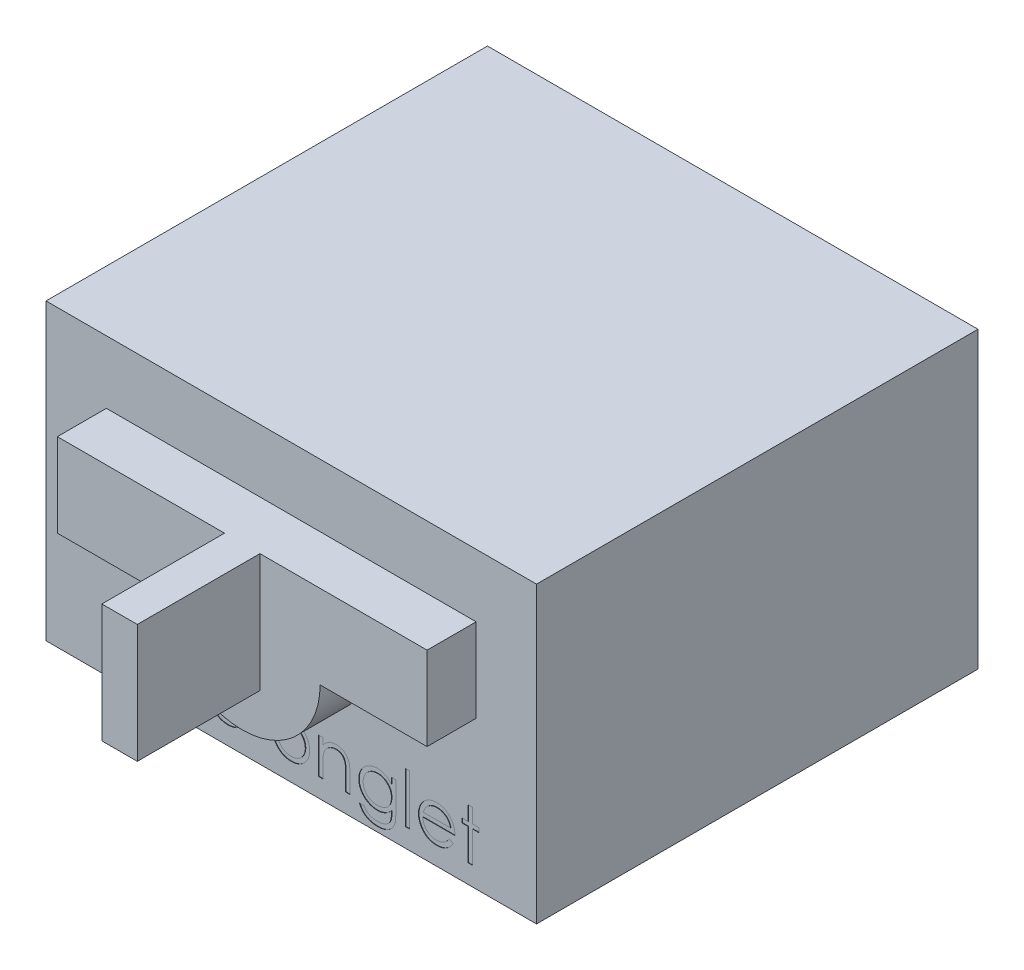
from build123d import *

# Parameters (mm, degrees)
ESQUISSE1_W             = 1000
ESQUISSE1_H             = 600
BOSS_EXTRU_1_DEPTH      = 900
BOSS_EXTRU_2_DEPTH      = 100
ESQUISSE3_W             = 72.275532634
ESQUISSE3_H             = 241.788641103
BOSS_EXTRU_3_DEPTH      = 250
ESQUISSE4_W             = 8.974358975
ESQUISSE4_H             = 73.076923077
ESQUISSE4_H_2           = 102.564102564
ENL_V_MAT_EXTRU_1_DEPTH = 1


with BuildPart() as part:
    # Esquisse1 → Boss.-Extru.1 (new body)
    with BuildSketch(Plane.XY):
        with Locations((500, 300)):
            Rectangle(ESQUISSE1_W, ESQUISSE1_H)
    extrude(amount=BOSS_EXTRU_1_DEPTH)

    # Esquisse2 → Boss.-Extru.2 (add)
    with BuildSketch(Plane.XY.offset(900)):
        with BuildLine():
            Line((123.134722697, 471.915742675), (123.134722697, 301.548761414))
            Line((123.134722697, 301.548761414), (341.132582134, 301.548761414))
            ThreePointArc((341.132582134, 301.548761414), (500, 142.681343548), (658.867417866, 301.548761414))
            Line((658.867417866, 301.548761414), (876.865277303, 301.548761414))
            Line((876.865277303, 301.548761414), (876.865277303, 471.915742675))
            Line((876.865277303, 471.915742675), (123.134722697, 471.915742675))
        make_face()
    extrude(amount=BOSS_EXTRU_2_DEPTH)

    # Esquisse3 → Boss.-Extru.3 (add)
    with BuildSketch(Plane.XY.offset(1000)):
        with Locations((500, 351.021422124)):
            Rectangle(ESQUISSE3_W, ESQUISSE3_H)
    extrude(amount=BOSS_EXTRU_3_DEPTH)

    # Esquisse4 → Enlèv. mat.-Extru.1 (cut)
    # profile 1 of 11: a face of its own
    with BuildSketch(Plane.XY.offset(900)):
        with BuildLine():
            Line((140.153931788, 57.550186491), (148.607457429, 62.618295465))
            add(Edge.make_bspline(
                [(148.607457429, 62.618295465), (149.393692779, 61.302170181), (150.900089368, 58.780524926), (153.412985344, 55.373152342), (156.016782806, 52.477090721), (158.730763764, 50.109187648), (161.538362282, 48.244933741), (164.457906675, 46.924869978), (167.479558409, 46.101556396), (169.535953309, 46.001553923), (170.562585634, 45.951628798)],
                knots=[0, 0, 0, 0, 1.272034388, 2.437168799, 3.508375237, 4.49857839, 5.41946034, 6.295179144, 7.148887113, 8, 8, 8, 8], degree=3))
            add(Edge.make_bspline(
                [(170.562585634, 45.951628798), (171.439353077, 45.976048013), (173.177546593, 46.024459163), (175.73646782, 46.489624936), (178.221662171, 47.204257191), (180.581908963, 48.227712377), (182.784640807, 49.465954826), (184.716260673, 50.961559898), (186.386149621, 52.636022918), (187.752124323, 54.504098765), (188.800125332, 56.513160154), (189.605613, 58.575330192), (190.052615105, 60.723003571), (190.119950918, 62.169016796), (190.153931788, 62.898744183)],
                knots=[0, 0, 0, 0, 1.095163259, 2.171163733, 3.241058638, 4.321873601, 5.38011039, 6.391990106, 7.366004449, 8.327778327, 9.272591725, 10.192022065, 11.087607919, 12, 12, 12, 12], degree=3))
            add(Edge.make_bspline(
                [(190.153931788, 62.898744183), (190.111808625, 63.731339889), (190.02617839, 65.423885293), (189.302421817, 67.921018235), (188.163871907, 70.392234521), (187.113510658, 71.920842109), (186.568194608, 72.714449311)],
                knots=[0, 0, 0, 0, 0.938893495, 1.908633276, 2.914225137, 4, 4, 4, 4], degree=3))
            add(Edge.make_bspline(
                [(186.568194608, 72.714449311), (186.120462774, 73.2872157), (185.180505795, 74.489667087), (183.564576864, 76.279530958), (181.668402169, 78.1257715), (179.556872029, 80.098887412), (177.15306949, 82.107110175), (174.532283365, 84.24620383), (171.62760168, 86.434820317), (169.590473205, 87.902607904), (168.539348454, 88.659962132)],
                knots=[0, 0, 0, 0, 0.722233717, 1.516239348, 2.393582979, 3.351407094, 4.387010283, 5.505090956, 6.712668013, 8, 8, 8, 8], degree=3))
            add(Edge.make_bspline(
                [(168.539348454, 88.659962132), (167.487234278, 89.409350349), (165.47567209, 90.842123556), (162.662569737, 92.968531671), (160.147013651, 94.912642229), (157.940184608, 96.692756861), (156.043053269, 98.309116996), (154.440670097, 99.746200971), (153.17385418, 101.042874139), (152.469409019, 101.884055332), (152.153130506, 102.261724952)],
                knots=[0, 0, 0, 0, 1.452282411, 2.77665338, 3.964542531, 5.026858415, 5.96415736, 6.766646006, 7.446254459, 8, 8, 8, 8], degree=3))
            add(Edge.make_bspline(
                [(152.153130506, 102.261724952), (151.711057785, 102.850326005), (150.84166245, 104.00788897), (149.694062294, 105.81717062), (148.718657642, 107.669263918), (147.954019581, 109.569145763), (147.310127615, 111.490143731), (146.87704388, 113.457322179), (146.605861111, 115.461854135), (146.578090067, 116.810811296), (146.564188198, 117.486083926)],
                knots=[0, 0, 0, 0, 1.068054152, 2.10047183, 3.106115577, 4.101338837, 5.06977816, 6.043150881, 7.020423561, 8, 8, 8, 8], degree=3))
            add(Edge.make_bspline(
                [(146.564188198, 117.486083926), (146.601479883, 118.544077485), (146.675266171, 120.637450735), (147.29928095, 123.695474462), (148.284220769, 126.615086382), (149.664074708, 129.367381632), (151.44285622, 131.880695371), (153.50131263, 134.183937857), (155.95306938, 136.120183063), (158.64314433, 137.81195616), (161.587612104, 139.136125451), (164.673066487, 140.135010599), (167.904411402, 140.70098939), (170.093072391, 140.782211245), (171.203611275, 140.82342367)],
                knots=[0, 0, 0, 0, 1.005424448, 1.989358655, 2.955360095, 3.929531133, 4.905563448, 5.876582895, 6.856512386, 7.866279853, 8.892233794, 9.918561126, 10.94386622, 12, 12, 12, 12], degree=3))
            add(Edge.make_bspline(
                [(171.203611275, 140.82342367), (172.382014141, 140.782779339), (174.725481333, 140.701950736), (178.172601778, 139.999164127), (181.49147939, 138.83628779), (184.161286956, 137.516611848), (186.250794426, 136.198571399), (187.844301074, 134.998004991), (189.459085383, 133.615859031), (191.108172663, 132.048452), (192.763620076, 130.281401969), (194.450004426, 128.326810857), (196.171269249, 126.196623546), (197.278579538, 124.675923525), (197.84623948, 123.896340337)],
                knots=[0, 0, 0, 0, 1.286793592, 2.559021753, 3.825965368, 5.121522368, 5.803751409, 6.523245864, 7.299691795, 8.125521123, 9.008227632, 9.944561021, 10.946284179, 12, 12, 12, 12], degree=3))
            Line((197.84623948, 123.896340337), (189.733258711, 117.746500593))
            add(Edge.make_bspline(
                [(189.733258711, 117.746500593), (189.243374926, 118.377606034), (188.299973295, 119.592967554), (186.867702242, 121.295005143), (185.517740873, 122.849761701), (184.18772945, 124.200193931), (182.947911409, 125.420254883), (181.744567344, 126.464819364), (180.595014452, 127.34412209), (179.145959862, 128.282509518), (177.325453624, 129.212695334), (175.04018116, 129.99981185), (172.652001874, 130.472813619), (171.025440974, 130.535353264), (170.202008711, 130.567013414)],
                knots=[0, 0, 0, 0, 1.181633172, 2.275549214, 3.290209073, 4.226197932, 5.078386478, 5.862611352, 6.581680152, 7.217281963, 8.414376989, 9.595101626, 10.782541182, 12, 12, 12, 12], degree=3))
            add(Edge.make_bspline(
                [(170.202008711, 130.567013414), (169.168965213, 130.532393415), (167.176838144, 130.465632009), (164.348545684, 129.736489572), (161.803004968, 128.58843642), (159.615788824, 126.979437046), (157.794732337, 125.07312297), (156.477433515, 122.879441396), (155.684571671, 120.457087036), (155.587820823, 118.767325426), (155.538547172, 117.906757003)],
                knots=[0, 0, 0, 0, 1.14458467, 2.207223713, 3.21896685, 4.227309161, 5.202851033, 6.127160689, 7.046193047, 8, 8, 8, 8], degree=3))
            add(Edge.make_bspline(
                [(155.538547172, 117.906757003), (155.549779362, 117.371000474), (155.572262108, 116.298611347), (155.885827756, 114.714285005), (156.288665726, 113.133961022), (156.927026633, 111.56474437), (157.808321023, 109.979191254), (158.965611763, 108.349998752), (160.423134964, 106.662807076), (161.539621031, 105.565453539), (162.129092044, 104.986083926)],
                knots=[0, 0, 0, 0, 0.858281714, 1.717966888, 2.583508476, 3.4729293, 4.427298488, 5.488583878, 6.674047936, 8, 8, 8, 8], degree=3))
            add(Edge.make_bspline(
                [(162.129092044, 104.986083926), (162.347988399, 104.790740332), (162.868036031, 104.326648665), (163.818776766, 103.566869218), (165.074285287, 102.629647153), (166.60177675, 101.470009539), (168.429415656, 100.124824907), (170.557402974, 98.611293131), (172.962018198, 96.880280017), (174.668358653, 95.670064571), (175.570598454, 95.030154439)],
                knots=[0, 0, 0, 0, 0.420754252, 0.999615792, 1.744751191, 2.668019286, 3.750313428, 4.999500688, 6.413464383, 8, 8, 8, 8], degree=3))
            add(Edge.make_bspline(
                [(175.570598454, 95.030154439), (176.655910263, 94.240401309), (178.75746616, 92.711153831), (181.747682729, 90.413562973), (184.458934388, 88.166483871), (186.900740205, 85.984266525), (189.097223303, 83.883463868), (191.024015322, 81.838801573), (192.700749046, 79.864928067), (194.505869574, 77.334283048), (196.350378703, 74.226252068), (197.934421772, 70.418302396), (198.9332317, 66.595550381), (199.063846426, 64.026212196), (199.128290762, 62.758519824)],
                knots=[0, 0, 0, 0, 1.163667725, 2.253281268, 3.268753668, 4.215851969, 5.092017293, 5.902905408, 6.650798638, 7.335211899, 8.59617414, 9.77448103, 10.901945474, 12, 12, 12, 12], degree=3))
            add(Edge.make_bspline(
                [(199.128290762, 62.758519824), (199.109515387, 61.861995107), (199.072329242, 60.086355577), (198.644874563, 57.479067666), (198.018598415, 54.946757104), (197.074677445, 52.52072532), (195.922587209, 50.156589243), (194.460694413, 47.916363517), (192.766189135, 45.750466414), (190.822367281, 43.716652376), (188.6953415, 41.849618205), (186.447235938, 40.188787877), (184.074370997, 38.803978637), (181.589619092, 37.673954578), (178.992409472, 36.790139792), (176.283615648, 36.149772103), (173.45877247, 35.756751791), (171.538758711, 35.715958606), (170.562585634, 35.695218542)],
                knots=[0, 0, 0, 0, 0.983748083, 1.948392443, 2.894712957, 3.844097841, 4.80183111, 5.778335162, 6.776009319, 7.81870978, 8.863265674, 9.881300176, 10.883814829, 11.87499822, 12.874611388, 13.892143829, 14.928324115, 16, 16, 16, 16], degree=3))
            add(Edge.make_bspline(
                [(170.562585634, 35.695218542), (169.80729012, 35.70982373), (168.306211261, 35.73885017), (166.085940351, 35.995458182), (163.910523516, 36.358518285), (161.807258316, 36.934920284), (159.749046554, 37.634262485), (157.744839854, 38.495357702), (155.793666886, 39.527277744), (153.88459309, 40.70713559), (152.022473816, 42.080214006), (150.224774732, 43.679456762), (148.432512289, 45.460756904), (146.69858668, 47.472487286), (144.987925414, 49.682146796), (143.33425657, 52.110409179), (141.703350351, 54.744047858), (140.68005127, 56.597336021), (140.153931788, 57.550186491)],
                knots=[0, 0, 0, 0, 0.915332311, 1.819136955, 2.706846663, 3.586547465, 4.459518054, 5.340707479, 6.227863349, 7.133153174, 8.059268498, 9.028702269, 10.047606654, 11.120612155, 12.245963614, 13.433783089, 14.680604001, 16, 16, 16, 16], degree=3))
        make_face()
    # profile 2 of 11: a face of its own
    with BuildSketch(Plane.XY.offset(900)):
        with BuildLine():
            Line((288.871880506, 95.490891619), (281.359861275, 90.82342367))
            add(Edge.make_bspline(
                [(281.359861275, 90.82342367), (280.536150835, 91.847092065), (278.914816686, 93.862009503), (276.099409933, 96.46229331), (273.099083812, 98.695637361), (269.862568163, 100.515744531), (266.394402448, 101.922071684), (262.70826384, 102.917220413), (258.804677986, 103.537341637), (256.128529442, 103.60782269), (254.757297172, 103.643936491)],
                knots=[0, 0, 0, 0, 1.026593902, 2.0206758, 2.988051866, 3.946915611, 4.916868779, 5.907761954, 6.927957743, 8, 8, 8, 8], degree=3))
            add(Edge.make_bspline(
                [(254.757297172, 103.643936491), (253.661326975, 103.613740999), (251.502843471, 103.554271799), (248.33409623, 103.182543417), (245.315743283, 102.507057466), (242.428865886, 101.617030132), (239.693996785, 100.424164705), (237.103970544, 98.972457387), (234.635813686, 97.285313378), (232.361049648, 95.330726367), (230.280220874, 93.205050148), (228.477394759, 90.926373138), (226.907768096, 88.562947675), (225.676169344, 86.05575504), (224.66830733, 83.462153518), (224.005258182, 80.733186213), (223.563409741, 77.903814568), (223.512857495, 75.974719147), (223.487265121, 74.998103157)],
                knots=[0, 0, 0, 0, 1.112346261, 2.190735716, 3.231507886, 4.247384806, 5.251966152, 6.253067467, 7.256802811, 8.280671706, 9.291813951, 10.270744147, 11.225547591, 12.165006084, 13.100104208, 14.043489273, 15.009504848, 16, 16, 16, 16], degree=3))
            add(Edge.make_bspline(
                [(223.487265121, 74.998103157), (223.538100898, 73.718982842), (223.639087485, 71.177977248), (224.430557763, 67.42717434), (225.726112257, 63.800783187), (227.499193705, 60.324550698), (229.741397545, 57.107574833), (232.374899354, 54.222333279), (235.401158875, 51.724732473), (238.793511183, 49.654088899), (242.472303853, 47.989478396), (246.397735417, 46.803554599), (250.537729144, 46.087772526), (253.372207632, 45.997602725), (254.817393326, 45.951628798)],
                knots=[0, 0, 0, 0, 0.966302908, 1.919585723, 2.883856336, 3.870342332, 4.860282998, 5.839159637, 6.814385684, 7.815993281, 8.834850808, 9.858348828, 10.908058873, 12, 12, 12, 12], degree=3))
            add(Edge.make_bspline(
                [(254.817393326, 45.951628798), (256.141827166, 45.98875729), (258.74469112, 46.061724628), (262.549470694, 46.676837866), (266.171753861, 47.683798826), (269.611411877, 49.088017399), (272.862159479, 50.903089282), (275.902993048, 53.141922733), (278.794419856, 55.740111314), (280.494333473, 57.749196208), (281.359861275, 58.772141619)],
                knots=[0, 0, 0, 0, 1.039848629, 2.043578496, 3.018386758, 3.987534228, 4.954977003, 5.934852016, 6.948509513, 8, 8, 8, 8], degree=3))
            Line((281.359861275, 58.772141619), (288.871880506, 53.844257003))
            add(Edge.make_bspline(
                [(288.871880506, 53.844257003), (288.426517585, 53.190236234), (287.53726996, 51.884365474), (286.050766375, 50.043104997), (284.447342612, 48.31962836), (282.73325413, 46.716245785), (280.930882421, 45.194588093), (278.978656432, 43.82740025), (276.939524676, 42.537833887), (274.789548741, 41.377466109), (272.550957369, 40.334428351), (270.226900523, 39.437537759), (267.827477303, 38.666963305), (265.349866555, 38.054467683), (262.789183746, 37.565586583), (260.152051334, 37.24119511), (257.439377574, 36.999044221), (255.605887536, 36.984590881), (254.677168967, 36.977269824)],
                knots=[0, 0, 0, 0, 0.954134338, 1.905101784, 2.851144739, 3.791306361, 4.734911809, 5.6936923, 6.663572882, 7.643865596, 8.638447847, 9.640600242, 10.646758161, 11.676244097, 12.717260333, 13.78922464, 14.880174919, 16, 16, 16, 16], degree=3))
            add(Edge.make_bspline(
                [(254.677168967, 36.977269824), (253.259715148, 37.002734961), (250.481495374, 37.052646815), (246.415138013, 37.601460397), (242.529033236, 38.428820863), (238.824508722, 39.616356117), (235.300987744, 41.145063982), (231.961755794, 43.012404399), (228.81786956, 45.23388411), (225.900418624, 47.769963235), (223.220948734, 50.519695834), (220.920200438, 53.486836346), (218.924621277, 56.562294856), (217.322120047, 59.8139956), (216.046493577, 63.19872053), (215.174926932, 66.743584529), (214.61122014, 70.419363216), (214.545980725, 72.926016989), (214.512906147, 74.196821106)],
                knots=[0, 0, 0, 0, 1.1129367, 2.181364009, 3.217532258, 4.231199276, 5.232079859, 6.230262199, 7.231623845, 8.250719726, 9.263571943, 10.242672461, 11.195837495, 12.138959767, 13.085126421, 14.0317438, 15.002148558, 16, 16, 16, 16], degree=3))
            add(Edge.make_bspline(
                [(214.512906147, 74.196821106), (214.525506608, 75.059062093), (214.550571004, 76.774201731), (214.838054654, 79.319775065), (215.209439595, 81.831447789), (215.838746369, 84.277382627), (216.565621559, 86.694676629), (217.493493896, 89.054193809), (218.581933751, 91.366898747), (219.817703674, 93.626833879), (221.208810677, 95.796820721), (222.748274484, 97.846925426), (224.378112662, 99.801775868), (226.174573005, 101.593883316), (228.061420258, 103.294917353), (230.092036707, 104.859435191), (232.254775325, 106.292034933), (234.51715597, 107.619206802), (236.877862009, 108.800904948), (239.322624018, 109.818997458), (241.836710568, 110.689071055), (244.424143259, 111.377897319), (247.067748206, 111.955537986), (249.788357862, 112.318905023), (252.575564212, 112.575655678), (254.462879147, 112.603964026), (255.418354865, 112.618295465)],
                knots=[0, 0, 0, 0, 0.990994727, 1.971252077, 2.943264845, 3.907940874, 4.872158414, 5.844625996, 6.82015047, 7.809835459, 8.804511986, 9.781214284, 10.756496977, 11.728388426, 12.696359165, 13.676225489, 14.672885716, 15.677705647, 16.690706858, 17.706033469, 18.721040654, 19.747369689, 20.783475414, 21.830280724, 22.901553713, 24, 24, 24, 24], degree=3))
            add(Edge.make_bspline(
                [(255.418354865, 112.618295465), (256.61492938, 112.59195572), (259.00209737, 112.539407889), (262.543260418, 112.097160683), (266.032265957, 111.430405928), (269.407897485, 110.442610792), (272.629226469, 109.246506343), (275.644525046, 107.903285932), (278.382813728, 106.34344012), (280.89503056, 104.637151137), (283.185873913, 102.712553831), (285.278859416, 100.546640762), (287.216906536, 98.150684217), (288.31566972, 96.384806181), (288.871880506, 95.490891619)],
                knots=[0, 0, 0, 0, 1.095225653, 2.184976855, 3.262915854, 4.344593502, 5.400796181, 6.407717688, 7.363229445, 8.282371371, 9.184954523, 10.097238608, 11.036792983, 12, 12, 12, 12], degree=3))
        make_face()
    # profile 3 of 11: a face of its own
    with BuildSketch(Plane.XY.offset(900)):
        with BuildLine():
            add(Edge.make_bspline(
                [(309.985662557, 142.105474952), (310.542557294, 142.079642026), (311.633064146, 142.029056197), (313.210014651, 141.595871137), (314.645929282, 140.86159441), (315.919578793, 139.87646067), (317.012489841, 138.717905143), (317.777652995, 137.367591763), (318.269435741, 135.908773512), (318.328823035, 134.891199535), (318.359059993, 134.373103157)],
                knots=[0, 0, 0, 0, 1.055194115, 2.066272739, 3.074728998, 4.095836921, 5.109056067, 6.073838105, 7.019297344, 8, 8, 8, 8], degree=3))
            add(Edge.make_bspline(
                [(318.359059993, 134.373103157), (318.328141141, 133.868455924), (318.267018229, 132.870828066), (317.77803285, 131.437300293), (317.005968912, 130.105749337), (315.920279609, 128.949443331), (314.64574358, 127.964854188), (313.210063984, 127.230433077), (311.633051169, 126.797286295), (310.542552907, 126.746695188), (309.985662557, 126.720859567)],
                knots=[0, 0, 0, 0, 0.96129708, 1.900370562, 2.859976407, 3.87933698, 4.906634145, 5.921202961, 6.938410037, 8, 8, 8, 8], degree=3))
            add(Edge.make_bspline(
                [(309.985662557, 126.720859567), (309.435140409, 126.745708717), (308.363620976, 126.794074339), (306.810282623, 127.238931989), (305.386611498, 127.965105506), (304.110477993, 128.942996508), (303.04675819, 130.112850715), (302.272520321, 131.436487682), (301.784664267, 132.871034957), (301.723389164, 133.868525423), (301.692393326, 134.373103157)],
                knots=[0, 0, 0, 0, 1.054934014, 2.053291228, 3.073705704, 4.106921865, 5.123545215, 6.088680038, 7.033164197, 8, 8, 8, 8], degree=3))
            add(Edge.make_bspline(
                [(301.692393326, 134.373103157), (301.722710087, 134.891127432), (301.782254117, 135.908559792), (302.272886007, 137.368417875), (303.040309086, 138.710746498), (304.111182329, 139.882903625), (305.386424051, 140.861344618), (306.810331056, 141.587372661), (308.363608181, 142.032268072), (309.435136067, 142.080628481), (309.985662557, 142.105474952)],
                knots=[0, 0, 0, 0, 0.98631895, 1.937192651, 2.907499808, 3.917963147, 4.944918757, 5.95915025, 6.951458133, 8, 8, 8, 8], degree=3))
        make_face()
    # profile 4 of 11: a face of its own
    with BuildSketch(Plane.XY.offset(900)):
        with Locations((310.02572666, 74.797782645)):
            Rectangle(ESQUISSE4_W, ESQUISSE4_H)
    # profile 5 of 11: a face of its own
    with BuildSketch(Plane.XY.offset(900)):
        with BuildLine():
            Line((396.28373948, 61.336244183), (404.25649589, 57.149545465))
            add(Edge.make_bspline(
                [(404.25649589, 57.149545465), (403.621164598, 56.022593143), (402.385061498, 53.829990205), (400.259325844, 50.817651334), (398.030980913, 48.107716596), (395.59943897, 45.772583617), (393.037448143, 43.73682976), (390.330800863, 41.955749054), (387.465406071, 40.438077044), (384.44112822, 39.159433391), (381.232569616, 38.176304988), (377.831954862, 37.481898676), (374.232769279, 37.052662428), (371.765735569, 37.002801263), (370.50248948, 36.977269824)],
                knots=[0, 0, 0, 0, 1.120438281, 2.179929193, 3.190490725, 4.156257408, 5.095198341, 6.022838206, 6.959905092, 7.901321166, 8.864066838, 9.862729781, 10.905609505, 12, 12, 12, 12], degree=3))
            add(Edge.make_bspline(
                [(370.50248948, 36.977269824), (369.098432979, 37.010046262), (366.359525503, 37.073983597), (362.372675586, 37.625196867), (358.618977917, 38.524407115), (355.098643536, 39.780565443), (351.820293462, 41.421346132), (348.777411896, 43.420188469), (345.953996871, 45.766824317), (343.439019466, 48.481579845), (341.174908531, 51.386778625), (339.17702796, 54.41408961), (337.506815645, 57.555896024), (336.148169639, 60.792196711), (335.050887783, 64.102593669), (334.286124818, 67.517207028), (333.845274876, 71.02679515), (333.777719289, 73.401004741), (333.743675377, 74.597462132)],
                knots=[0, 0, 0, 0, 1.145258523, 2.234067595, 3.276747158, 4.290159414, 5.277019952, 6.260822364, 7.254936242, 8.264827045, 9.274100331, 10.257902744, 11.220704747, 12.172965371, 13.118907548, 14.062713208, 15.023725156, 16, 16, 16, 16], degree=3))
            add(Edge.make_bspline(
                [(333.743675377, 74.597462132), (333.773936558, 75.720171572), (333.833910223, 77.94523342), (334.21193272, 81.238534693), (334.88188395, 84.439347622), (335.801207491, 87.55033185), (336.988385954, 90.566278535), (338.440735074, 93.48902321), (340.160517297, 96.315455777), (341.488307976, 98.098402455), (342.157136916, 98.996500593)],
                knots=[0, 0, 0, 0, 1.024358464, 2.0301432, 3.019427413, 4.004406732, 4.986367066, 5.972626655, 6.978780325, 8, 8, 8, 8], degree=3))
            add(Edge.make_bspline(
                [(342.157136916, 98.996500593), (343.063070709, 100.07846831), (344.846240613, 102.208129751), (347.86213648, 105.006367631), (351.127856375, 107.350475493), (354.602474264, 109.293536526), (358.326373523, 110.76992644), (362.249496124, 111.870143075), (366.416512873, 112.486657676), (369.265233469, 112.573738636), (370.722842044, 112.618295465)],
                knots=[0, 0, 0, 0, 1.030682036, 2.02871468, 2.997146059, 3.962720338, 4.930598197, 5.918074684, 6.934738563, 8, 8, 8, 8], degree=3))
            add(Edge.make_bspline(
                [(370.722842044, 112.618295465), (372.221345053, 112.579608354), (375.161066365, 112.50371306), (379.447698395, 111.800103534), (383.503718868, 110.684316261), (387.327504705, 109.108493675), (390.919443584, 107.075363624), (394.256187857, 104.557025296), (397.394802501, 101.630794233), (399.220761897, 99.38041682), (400.149925377, 98.235282644)],
                knots=[0, 0, 0, 0, 1.056321875, 2.072262726, 3.055038591, 4.01806755, 4.982017516, 5.957941055, 6.960871419, 8, 8, 8, 8], degree=3))
            add(Edge.make_bspline(
                [(400.149925377, 98.235282644), (400.782123615, 97.372323176), (402.042311989, 95.652148357), (403.620800562, 92.847258154), (404.991011847, 89.912669744), (406.086239304, 86.80094697), (406.973082196, 83.548958965), (407.614705588, 80.133457687), (407.990980405, 76.55546022), (408.064943186, 74.117558635), (408.102649736, 72.874705721)],
                knots=[0, 0, 0, 0, 0.94817472, 1.890038105, 2.849395472, 3.817997239, 4.812318967, 5.836947057, 6.897266129, 8, 8, 8, 8], degree=3))
            Line((408.102649736, 72.874705721), (342.718034352, 72.874705721))
            add(Edge.make_bspline(
                [(342.718034352, 72.874705721), (342.762023107, 71.911835314), (342.84852522, 70.018389493), (343.251815024, 67.24779569), (343.887494275, 64.608557343), (344.780896065, 62.120470429), (345.862805929, 59.751038215), (347.188112123, 57.517837158), (348.769242236, 55.431039157), (350.532833647, 53.471978083), (352.495893514, 51.727384907), (354.561114863, 50.165905586), (356.758073863, 48.857174251), (359.069447677, 47.794891686), (361.491498681, 46.963282656), (364.02498997, 46.395630636), (366.664936151, 46.015427583), (368.464528552, 45.973151434), (369.380694608, 45.951628798)],
                knots=[0, 0, 0, 0, 1.094153842, 2.151609401, 3.174256925, 4.172055639, 5.149267565, 6.128595816, 7.11444997, 8.118368179, 9.117203808, 10.09244225, 11.054858984, 12.015122123, 12.976791628, 13.957293641, 14.960065497, 16, 16, 16, 16], degree=3))
            add(Edge.make_bspline(
                [(369.380694608, 45.951628798), (370.276441683, 45.969001846), (372.053775709, 46.003473304), (374.700657347, 46.338670759), (377.304643845, 46.880678634), (379.854957652, 47.620392636), (382.299838964, 48.522588411), (384.563997537, 49.611241486), (386.646289412, 50.815519965), (388.592488458, 52.192939252), (390.480231125, 53.878887452), (392.352873594, 55.982765195), (394.360777976, 58.470980274), (395.617623483, 60.343713588), (396.28373948, 61.336244183)],
                knots=[0, 0, 0, 0, 0.99110716, 1.966546729, 2.947904876, 3.932708344, 4.903319531, 5.828989031, 6.710028674, 7.56322171, 8.463672341, 9.504779593, 10.677557249, 12, 12, 12, 12], degree=3))
        make_face()
        with BuildLine():
            add(Edge.make_bspline(
                [(399.128290762, 81.849064696), (398.799815775, 83.039432516), (398.167607161, 85.33050739), (396.846568177, 88.50310426), (395.358809871, 91.322758574), (393.598188975, 93.767890947), (391.603368243, 95.93941989), (389.299220167, 97.837093752), (386.715337496, 99.534735211), (383.865076333, 100.967663767), (380.846739617, 102.187374016), (377.686562704, 103.005234466), (374.462054479, 103.565507103), (372.281074869, 103.61768163), (371.183579224, 103.643936491)],
                knots=[0, 0, 0, 0, 1.154881502, 2.222775134, 3.210006277, 4.132804581, 5.035138423, 5.962687519, 6.919655026, 7.923214229, 8.944639381, 9.960483929, 10.97369054, 12, 12, 12, 12], degree=3))
            add(Edge.make_bspline(
                [(371.183579224, 103.643936491), (370.28788098, 103.626460161), (368.517273864, 103.591913131), (365.908671916, 103.26419515), (363.403537661, 102.722485296), (360.983386587, 101.980629393), (358.679933205, 100.991812179), (356.44579697, 99.832291419), (354.337785649, 98.416817596), (353.019462921, 97.337993172), (352.353451018, 96.792974952)],
                knots=[0, 0, 0, 0, 1.04873581, 2.073130211, 3.073294108, 4.04793562, 5.032784715, 6.005352987, 6.992311501, 8, 8, 8, 8], degree=3))
            add(Edge.make_bspline(
                [(352.353451018, 96.792974952), (351.876500105, 96.361708791), (350.911267699, 95.48893119), (349.621538513, 93.985239574), (348.386667865, 92.363766369), (347.262849215, 90.562477095), (346.23206103, 88.601883409), (345.267490254, 86.498522403), (344.399307052, 84.236432967), (343.910846765, 82.66007756), (343.659540762, 81.849064696)],
                knots=[0, 0, 0, 0, 0.879870761, 1.780643979, 2.707998968, 3.669668524, 4.684282772, 5.740141944, 6.837334558, 8, 8, 8, 8], degree=3))
            Line((343.659540762, 81.849064696), (399.128290762, 81.849064696))
        make_face(mode=Mode.SUBTRACT)
    # profile 6 of 11: a face of its own
    with BuildSketch(Plane.XY.offset(900)):
        with BuildLine():
            add(Edge.make_bspline(
                [(499.809380506, 112.618295465), (501.18055973, 112.589098575), (503.869107089, 112.53185061), (507.806475257, 111.919994448), (511.564907712, 110.984355466), (515.158798917, 109.690882264), (518.542121644, 107.957112248), (521.76415719, 105.888275359), (524.81607173, 103.437344114), (526.645301137, 101.541399304), (527.573803583, 100.579032644)],
                knots=[0, 0, 0, 0, 1.054011418, 2.066658804, 3.057071809, 4.030435133, 4.997543892, 5.974964718, 6.972108034, 8, 8, 8, 8], degree=3))
            add(Edge.make_bspline(
                [(527.573803583, 100.579032644), (528.373287984, 99.65863305), (529.956784563, 97.83564613), (531.987233671, 94.879771474), (533.736421104, 91.818625743), (535.138219989, 88.611559266), (536.24350638, 85.286568662), (537.028240559, 81.832225486), (537.495010129, 78.256158424), (537.557952041, 75.827477336), (537.589829224, 74.597462132)],
                knots=[0, 0, 0, 0, 1.025258237, 2.030674902, 3.01204498, 3.988269485, 4.97094183, 5.956517959, 6.965070386, 8, 8, 8, 8], degree=3))
            add(Edge.make_bspline(
                [(537.589829224, 74.597462132), (537.561791014, 73.360317626), (537.506386206, 70.915662389), (536.98228288, 67.31510908), (536.167108998, 63.823828432), (535.00048505, 60.456437182), (533.504539071, 57.202642113), (531.679090856, 54.076654991), (529.511330366, 51.072308326), (527.054073316, 48.215112947), (524.338305426, 45.581792525), (521.392129759, 43.286699109), (518.273443081, 41.320369841), (514.940775844, 39.736472252), (511.424561935, 38.487623672), (507.717217132, 37.610480345), (503.824500837, 37.080146523), (501.166580227, 37.01204443), (499.809380506, 36.977269824)],
                knots=[0, 0, 0, 0, 0.998656419, 1.973391657, 2.932242238, 3.890759089, 4.846373663, 5.82037756, 6.809684879, 7.83454468, 8.860553229, 9.859544525, 10.845671541, 11.83227036, 12.833544569, 13.85385346, 14.904124723, 16, 16, 16, 16], degree=3))
            add(Edge.make_bspline(
                [(499.809380506, 36.977269824), (498.445531377, 37.012161144), (495.774363956, 37.080497558), (491.86790733, 37.608419922), (488.153918217, 38.487219424), (484.633101117, 39.740576359), (481.286105489, 41.320420466), (478.149348434, 43.280754454), (475.200779419, 45.582473175), (472.484437007, 48.21492852), (470.027333998, 51.072355843), (467.859533759, 54.076642657), (466.034095869, 57.202645327), (464.538147187, 60.456436325), (463.371523961, 63.823828662), (462.556349884, 67.315109018), (462.032246611, 70.915662405), (461.976841795, 73.360317632), (461.948803583, 74.597462132)],
                knots=[0, 0, 0, 0, 1.099876186, 2.154163076, 3.173186993, 4.173200201, 5.163417411, 6.152872554, 7.150605724, 8.17532212, 9.198891216, 10.186952605, 11.159729845, 12.11414092, 13.071450619, 14.029093627, 15.002601286, 16, 16, 16, 16], degree=3))
            add(Edge.make_bspline(
                [(461.948803583, 74.597462132), (461.980898164, 75.820792014), (462.04443992, 78.24277494), (462.510740179, 81.81211953), (463.292413221, 85.260616361), (464.399024549, 88.572772817), (465.813744288, 91.765785276), (467.538352515, 94.834494732), (469.589513445, 97.777003317), (471.16671206, 99.597634175), (471.964829224, 100.518936491)],
                knots=[0, 0, 0, 0, 1.031353054, 2.041901799, 3.029428768, 4.008703097, 4.981709435, 5.96992636, 6.972712378, 8, 8, 8, 8], degree=3))
            add(Edge.make_bspline(
                [(471.964829224, 100.518936491), (472.891931824, 101.489649041), (474.71524222, 103.398726075), (477.782348727, 105.842512478), (480.996457901, 107.954400302), (484.417170076, 109.653720744), (488.008108875, 110.991964107), (491.785801519, 111.922407396), (495.736530532, 112.52964611), (498.438233992, 112.58845119), (499.809380506, 112.618295465)],
                knots=[0, 0, 0, 0, 1.027980169, 2.021703884, 2.998553061, 3.971491411, 4.943284454, 5.930300938, 6.949603206, 8, 8, 8, 8], degree=3))
        make_face()
        with BuildLine():
            add(Edge.make_bspline(
                [(499.769316403, 103.643936491), (498.799670365, 103.616376728), (496.885409546, 103.561968655), (494.067707126, 103.148142806), (491.355131299, 102.492499833), (488.742535753, 101.560955368), (486.238730827, 100.358129685), (483.841319329, 98.880747965), (481.543249618, 97.14837778), (479.389476379, 95.16373002), (477.412838888, 92.995758747), (475.6848967, 90.685805636), (474.215607947, 88.2713386), (472.991603405, 85.749846853), (472.07996946, 83.095777884), (471.417883103, 80.33918842), (471.004447661, 77.474462235), (470.95055113, 75.527004569), (470.923162557, 74.537365978)],
                knots=[0, 0, 0, 0, 1.021534396, 2.016698045, 2.994645724, 3.958388632, 4.93408049, 5.916473867, 6.921342795, 7.962252576, 8.998418191, 10.008913653, 10.997312074, 11.973003931, 12.956656626, 13.948281152, 14.957379055, 16, 16, 16, 16], degree=3))
            add(Edge.make_bspline(
                [(470.923162557, 74.537365978), (470.969071804, 73.25873663), (471.060193074, 70.720896473), (471.801199829, 66.983435826), (473.040807826, 63.395382908), (474.714730103, 59.977771878), (476.812050637, 56.815706792), (479.283109685, 53.996521524), (482.101386838, 51.562641197), (485.233286843, 49.543188467), (488.614838784, 47.938624019), (492.193590815, 46.801510427), (495.926182074, 46.062319215), (498.477060107, 45.988848519), (499.769316403, 45.951628798)],
                knots=[0, 0, 0, 0, 1.016792936, 2.018143844, 3.017858371, 4.030088057, 5.03801393, 6.028138512, 7.003788237, 7.991172063, 8.984598303, 9.972568034, 10.972917682, 12, 12, 12, 12], degree=3))
            add(Edge.make_bspline(
                [(499.769316403, 45.951628798), (501.061498373, 45.989065377), (503.612229686, 46.062964144), (507.339634739, 46.797787565), (510.908605363, 47.943606442), (514.286645007, 49.541383868), (517.417119391, 51.570310004), (520.255665714, 53.98277792), (522.705626032, 56.823173673), (524.800871887, 59.981960211), (526.502207393, 63.390084556), (527.736013158, 66.984098051), (528.478801326, 70.72072782), (528.569682147, 73.258680127), (528.615470249, 74.537365978)],
                knots=[0, 0, 0, 0, 1.02726834, 2.027799167, 3.010890988, 4.004497153, 4.992059811, 5.971914811, 6.958719428, 7.966827853, 8.981595046, 9.981490638, 10.983022906, 12, 12, 12, 12], degree=3))
            add(Edge.make_bspline(
                [(528.615470249, 74.537365978), (528.588091106, 75.527010484), (528.534213131, 77.474479788), (528.12064272, 80.33912132), (527.459055872, 83.09602408), (526.545581094, 85.74893846), (525.326894984, 88.277867155), (523.829272324, 90.678716499), (522.108385884, 93.003760672), (520.107896716, 95.156721838), (517.956371633, 97.149151454), (515.657370542, 98.881419723), (513.263514012, 100.351636737), (510.766983078, 101.57124361), (508.154052574, 102.484024762), (505.445277455, 103.15192852), (502.639597171, 103.560219852), (500.732195938, 103.615852465), (499.769316403, 103.643936491)],
                knots=[0, 0, 0, 0, 1.042956736, 2.052379634, 3.044323526, 4.02829302, 5.004299113, 5.996692471, 7.007513377, 8.048758398, 9.090003419, 10.095195979, 11.07790575, 12.047570684, 13.018257071, 13.989683339, 14.985167495, 16, 16, 16, 16], degree=3))
        make_face(mode=Mode.SUBTRACT)
    # profile 7 of 11: a face of its own
    with BuildSketch(Plane.XY.offset(900)):
        with BuildLine():
            Line((555.538547172, 111.336244183), (564.512906147, 111.336244183))
            Line((564.512906147, 111.336244183), (564.512906147, 98.155154439))
            add(Edge.make_bspline(
                [(564.512906147, 98.155154439), (565.471124293, 99.350660806), (567.330580037, 101.67058262), (570.427275274, 104.719741893), (573.69995814, 107.232462609), (577.128586811, 109.23542815), (580.717815671, 110.745331754), (584.445766242, 111.835786928), (588.334757844, 112.489639172), (590.979456041, 112.575074324), (592.317393326, 112.618295465)],
                knots=[0, 0, 0, 0, 1.12780773, 2.188550248, 3.19190651, 4.159438251, 5.104880172, 6.052711206, 7.014878035, 8, 8, 8, 8], degree=3))
            add(Edge.make_bspline(
                [(592.317393326, 112.618295465), (593.669697158, 112.568432738), (596.316481951, 112.470839354), (600.170140848, 111.698933894), (603.769380668, 110.380498033), (607.101367976, 108.574438879), (610.105002643, 106.328539638), (612.742855543, 103.712031588), (614.924662611, 100.70242921), (616.387444411, 97.910339032), (617.351034345, 95.433516338), (617.957672559, 93.312180621), (618.472843458, 90.948804873), (618.91946483, 88.350530901), (619.221668026, 85.499154036), (619.460019213, 82.406362835), (619.63083905, 79.073159106), (619.637616392, 76.767826894), (619.641111275, 75.579032644)],
                knots=[0, 0, 0, 0, 1.235846778, 2.418850247, 3.575807741, 4.728682307, 5.871620074, 6.994088408, 8.11269785, 9.256955736, 9.865816715, 10.540099792, 11.271859618, 12.076849838, 12.949306005, 13.892391288, 14.913166135, 16, 16, 16, 16], degree=3))
            Line((619.641111275, 75.579032644), (619.641111275, 38.259321106))
            Line((619.641111275, 38.259321106), (610.6667523, 38.259321106))
            Line((610.6667523, 38.259321106), (610.6667523, 72.634321106))
            add(Edge.make_bspline(
                [(610.6667523, 72.634321106), (610.661232071, 73.629248104), (610.650672813, 75.532374126), (610.617368622, 78.25720336), (610.537088433, 80.728248457), (610.424279492, 82.939601812), (610.259164334, 84.889139999), (610.087089153, 86.58083362), (609.876661245, 88.012534833), (609.689149441, 88.874394329), (609.605053583, 89.26092367)],
                knots=[0, 0, 0, 0, 1.430800155, 2.736877192, 3.918605307, 4.986035426, 5.920637409, 6.731861385, 7.431261377, 8, 8, 8, 8], degree=3))
            add(Edge.make_bspline(
                [(609.605053583, 89.26092367), (609.301466968, 90.395528954), (608.717156663, 92.579293086), (607.273328574, 95.541417447), (605.450066266, 98.061365671), (603.224413427, 100.123557717), (600.617868408, 101.728438766), (597.637664329, 102.841980329), (594.31256031, 103.538445164), (591.973863662, 103.607791793), (590.754893326, 103.643936491)],
                knots=[0, 0, 0, 0, 1.084156227, 2.086665306, 3.027808233, 3.945421172, 4.874247719, 5.839848303, 6.874090471, 8, 8, 8, 8], degree=3))
            add(Edge.make_bspline(
                [(590.754893326, 103.643936491), (590.032959509, 103.630336357), (588.604271137, 103.603422045), (586.485700511, 103.333384959), (584.430724135, 102.891714799), (582.418718164, 102.295468013), (580.489924057, 101.476546035), (578.58237288, 100.547135457), (576.767893905, 99.388615115), (575.007796844, 98.097454502), (573.370288054, 96.666620011), (571.846621243, 95.156776864), (570.488392093, 93.54890247), (569.257858513, 91.868903969), (568.195622417, 90.093708597), (567.268391329, 88.240442698), (566.481657192, 86.306667017), (566.090723122, 84.964522411), (565.895117685, 84.292974952)],
                knots=[0, 0, 0, 0, 1.023777757, 2.026029729, 3.023749952, 4.003683103, 4.997618607, 5.993177895, 7.010360494, 8.046726602, 9.087585522, 10.09234134, 11.086953743, 12.070360549, 13.043493632, 14.017870808, 15.008233677, 16, 16, 16, 16], degree=3))
            add(Edge.make_bspline(
                [(565.895117685, 84.292974952), (565.782556297, 83.799969151), (565.537516044, 82.72672131), (565.272853762, 80.965452185), (565.032637322, 78.928024328), (564.831581362, 76.616815269), (564.708569463, 74.023733123), (564.574443841, 71.159852043), (564.525613524, 68.013752376), (564.517260552, 65.823418298), (564.512906147, 64.681596747)],
                knots=[0, 0, 0, 0, 0.615963638, 1.340920617, 2.168419149, 3.115676021, 4.16674242, 5.331190069, 6.6087489, 8, 8, 8, 8], degree=3))
            Line((564.512906147, 64.681596747), (564.512906147, 38.259321106))
            Line((564.512906147, 38.259321106), (555.538547172, 38.259321106))
            Line((555.538547172, 38.259321106), (555.538547172, 111.336244183))
        make_face()
    # profile 8 of 11: a face of its own
    with BuildSketch(Plane.XY.offset(900)):
        with BuildLine():
            Line((704.25649589, 111.336244183), (713.230854865, 111.336244183))
            Line((713.230854865, 111.336244183), (713.230854865, 53.343455721))
            add(Edge.make_bspline(
                [(713.230854865, 53.343455721), (713.222939363, 52.108095875), (713.207660537, 49.723553798), (713.097632787, 46.275602952), (712.865613438, 43.090857651), (712.602508256, 40.15479312), (712.224030647, 37.481018547), (711.761848726, 35.061555556), (711.240829322, 32.894082346), (710.783108823, 31.559086888), (710.566592044, 30.927590337)],
                knots=[0, 0, 0, 0, 1.307562039, 2.523909702, 3.650326591, 4.686913197, 5.643429486, 6.506965704, 7.293745905, 8, 8, 8, 8], degree=3))
            add(Edge.make_bspline(
                [(710.566592044, 30.927590337), (710.246899509, 30.106735434), (709.617073039, 28.489568662), (708.437483512, 26.197159496), (707.116514837, 24.038691215), (705.607750533, 22.026192606), (703.918013275, 20.169766539), (702.087113499, 18.429080845), (700.079393744, 16.840961777), (697.896001967, 15.432810421), (695.58726959, 14.164608874), (693.154523816, 13.066135525), (690.61148272, 12.109368565), (687.934257246, 11.392717258), (685.164821975, 10.771725242), (682.270609659, 10.367591362), (679.26852975, 10.092532559), (677.227233176, 10.067097331), (676.191592044, 10.054192901)],
                knots=[0, 0, 0, 0, 0.981931301, 1.934503488, 2.87077864, 3.801706999, 4.735015492, 5.667491629, 6.616593066, 7.585388521, 8.561939025, 9.551802639, 10.560317337, 11.588439944, 12.640189604, 13.723962949, 14.845264515, 16, 16, 16, 16], degree=3))
            add(Edge.make_bspline(
                [(676.191592044, 10.054192901), (674.680599627, 10.078663924), (671.729225477, 10.126462407), (667.426225686, 10.683345695), (663.339519403, 11.470613497), (659.523106354, 12.662197144), (656.001103587, 14.12039685), (652.797564286, 15.794538363), (649.941246928, 17.714232901), (647.366284842, 19.899964355), (645.04223941, 22.498926688), (642.85574541, 25.561750806), (640.751147072, 29.135090496), (639.517757418, 31.757739445), (638.871880506, 33.131115978)],
                knots=[0, 0, 0, 0, 1.157897085, 2.2616841, 3.32207898, 4.345638746, 5.321241055, 6.241986252, 7.112515963, 7.955008012, 8.825025602, 9.77857164, 10.836726669, 12, 12, 12, 12], degree=3))
            Line((638.871880506, 33.131115978), (647.84623948, 33.131115978))
            add(Edge.make_bspline(
                [(647.84623948, 33.131115978), (648.568016889, 31.985233813), (649.979002843, 29.745175284), (652.617530871, 26.8447994), (655.509140195, 24.366131838), (658.751416857, 22.36868115), (662.357851583, 20.86268711), (666.330614045, 19.789107212), (670.702031809, 19.146356731), (673.745409357, 19.068891184), (675.330213839, 19.028551875)],
                knots=[0, 0, 0, 0, 0.997731894, 1.950442991, 2.880492273, 3.800895997, 4.748200782, 5.754801363, 6.83083817, 8, 8, 8, 8], degree=3))
            add(Edge.make_bspline(
                [(675.330213839, 19.028551875), (676.894982135, 19.069413269), (679.911698782, 19.148189947), (684.249732183, 19.789394066), (688.209587556, 20.862920745), (691.768450431, 22.366017495), (694.884329533, 24.207457682), (697.570386426, 26.264602665), (699.745948602, 28.584059894), (701.209176221, 30.720682925), (702.118736724, 32.624229488), (702.697943489, 34.262875087), (703.16862833, 36.115814449), (703.562337974, 38.176835483), (703.887221213, 40.448882828), (704.093017852, 42.937151496), (704.241755325, 45.63598642), (704.251468749, 47.50721894), (704.25649589, 48.47566726)],
                knots=[0, 0, 0, 0, 1.570740765, 3.028230971, 4.391408896, 5.680370741, 6.894727393, 8.017376726, 9.065722033, 10.075533815, 10.603371122, 11.180248986, 11.817768598, 12.521299649, 13.286540596, 14.121245857, 15.027658897, 16, 16, 16, 16], degree=3))
            Line((704.25649589, 48.47566726), (704.25649589, 52.261724952))
            add(Edge.make_bspline(
                [(704.25649589, 52.261724952), (703.345606822, 51.177673462), (701.539850944, 49.028638615), (698.421355883, 46.212591852), (695.015158293, 43.787273844), (691.327057082, 41.79817), (687.44739302, 40.207272154), (683.418186437, 39.094616129), (679.275556288, 38.375761846), (676.468352008, 38.298409954), (675.049765121, 38.259321106)],
                knots=[0, 0, 0, 0, 1.012485704, 2.007162095, 2.997754123, 3.998611389, 4.999708251, 5.992315798, 6.98544096, 8, 8, 8, 8], degree=3))
            add(Edge.make_bspline(
                [(675.049765121, 38.259321106), (674.214443138, 38.274036148), (672.55368435, 38.303292095), (670.086405858, 38.559257164), (667.655536191, 38.930649801), (665.266744659, 39.475833772), (662.916584286, 40.175597387), (660.608938797, 41.050361351), (658.325123752, 42.03936473), (656.106652384, 43.204301972), (653.975620078, 44.500367882), (651.948100502, 45.904336188), (650.034713671, 47.408858709), (648.253671116, 49.028771275), (646.607309074, 50.761729354), (645.073484273, 52.58925944), (643.677560071, 54.536880622), (642.390891807, 56.569079408), (641.274961796, 58.699391517), (640.295408315, 60.881622815), (639.443711028, 63.111107229), (638.76469955, 65.395309019), (638.246096314, 67.732788129), (637.860089829, 70.11971524), (637.641148924, 72.563440601), (637.607008237, 74.209764864), (637.589829224, 75.03816726)],
                knots=[0, 0, 0, 0, 1.028754217, 2.045334182, 3.052854819, 4.056607503, 5.061168794, 6.071104265, 7.095078842, 8.125279047, 9.155117945, 10.165957491, 11.161587969, 12.151493252, 13.128948131, 14.104219989, 15.088194871, 16.07871515, 17.064853787, 18.047899887, 19.02414258, 20.002704429, 20.980574569, 21.971845993, 22.979467364, 24, 24, 24, 24], degree=3))
            add(Edge.make_bspline(
                [(637.589829224, 75.03816726), (637.604662546, 75.866827145), (637.634271738, 77.520937397), (637.890014006, 79.974634122), (638.254819418, 82.395475129), (638.832184246, 84.758507749), (639.527113461, 87.090643514), (640.387786962, 89.374656554), (641.422608658, 91.611242528), (642.594315791, 93.802057713), (643.911004153, 95.917703854), (645.354789319, 97.927036594), (646.927414298, 99.815270077), (648.607183315, 101.601453559), (650.414606659, 103.268353365), (652.348749298, 104.811923791), (654.390545876, 106.258038827), (656.546324448, 107.575505603), (658.782821262, 108.740712646), (661.043216056, 109.803929701), (663.357451343, 110.647761688), (665.68238104, 111.391278803), (668.058950034, 111.917998667), (670.458018423, 112.324348436), (672.887799502, 112.571911894), (674.515025074, 112.602814322), (675.330213839, 112.618295465)],
                knots=[0, 0, 0, 0, 1.008818848, 2.013730394, 3.001654427, 3.987803273, 4.973046549, 5.963777569, 6.957074694, 7.972068341, 8.987420212, 9.989399531, 10.982630087, 11.977756091, 12.973280677, 13.973972381, 14.989194003, 16.018387222, 17.047741039, 18.059210846, 19.057554164, 20.045176975, 21.029480261, 22.018708529, 23.007435371, 24, 24, 24, 24], degree=3))
            add(Edge.make_bspline(
                [(675.330213839, 112.618295465), (676.674526381, 112.579533371), (679.32913059, 112.502990146), (683.23573066, 111.902385992), (687.005508945, 110.944842754), (690.659737964, 109.572967596), (694.228185136, 107.700109358), (697.699089573, 105.233167986), (701.082493407, 102.150015423), (703.170431422, 99.785647869), (704.25649589, 98.555795465)],
                knots=[0, 0, 0, 0, 0.96728863, 1.910097829, 2.838038873, 3.762875196, 4.71315279, 5.730631239, 6.819562287, 8, 8, 8, 8], degree=3))
            Line((704.25649589, 98.555795465), (704.25649589, 111.336244183))
        make_face()
        with BuildLine():
            add(Edge.make_bspline(
                [(676.051367685, 103.643936491), (674.73906186, 103.599334619), (672.140974592, 103.511032371), (668.332736235, 102.757183424), (664.656252422, 101.575871995), (661.181811616, 99.886082983), (657.927322762, 97.826247613), (655.039470749, 95.330810824), (652.513616003, 92.480919485), (650.376960623, 89.302340999), (648.676064438, 85.873133129), (647.471966739, 82.258540725), (646.693394646, 78.516969502), (646.60746173, 75.963466554), (646.564188198, 74.677590337)],
                knots=[0, 0, 0, 0, 1.026226791, 2.031711442, 3.026614839, 4.04107745, 5.047145931, 6.032893242, 7.017642609, 8.019221815, 9.021877557, 10.003543541, 10.994637589, 12, 12, 12, 12], degree=3))
            add(Edge.make_bspline(
                [(646.564188198, 74.677590337), (646.584924107, 73.708068264), (646.625705578, 71.801301864), (647.017807799, 69.003076301), (647.65154966, 66.337924483), (648.549755554, 63.805685212), (649.662689694, 61.39183393), (651.062471722, 59.112998651), (652.709642342, 56.967149906), (654.591309139, 54.970158999), (656.66492005, 53.151274187), (658.91404003, 51.553044454), (661.335618594, 50.245880999), (663.870098885, 49.116142782), (666.578977628, 48.291026555), (669.42323723, 47.661347154), (672.422999986, 47.301096939), (674.467906823, 47.256445573), (675.5105023, 47.23368008)],
                knots=[0, 0, 0, 0, 1.039728707, 2.044842319, 3.024901384, 3.974314358, 4.923051295, 5.871625912, 6.837440708, 7.820715446, 8.810779094, 9.792721783, 10.773906224, 11.758876063, 12.764959493, 13.806266761, 14.881525401, 16, 16, 16, 16], degree=3))
            add(Edge.make_bspline(
                [(675.5105023, 47.23368008), (676.566609678, 47.255611767), (678.631816462, 47.298498948), (681.64812893, 47.667170336), (684.506207227, 48.262083944), (687.203430723, 49.10674181), (689.749983325, 50.184506114), (692.117258028, 51.548409471), (694.356013687, 53.101678958), (696.394768246, 54.913450793), (698.238315833, 56.910164936), (699.844909172, 59.082876222), (701.21389343, 61.398891052), (702.34754114, 63.857948357), (703.213004116, 66.479158444), (703.793544259, 69.255968609), (704.199451264, 72.175075434), (704.23719197, 74.17532161), (704.25649589, 75.19842367)],
                knots=[0, 0, 0, 0, 1.121943988, 2.193949579, 3.223793937, 4.220241907, 5.192961521, 6.155822191, 7.11847367, 8.083710714, 9.04790392, 10.001595906, 10.949595423, 11.902125208, 12.873731292, 13.87582262, 14.913508608, 16, 16, 16, 16], degree=3))
            add(Edge.make_bspline(
                [(704.25649589, 75.19842367), (704.218222514, 76.530362355), (704.143449786, 79.132502497), (703.43781671, 82.92412444), (702.300096419, 86.488943691), (700.704474925, 89.815685858), (698.704988963, 92.869101564), (696.296678997, 95.592639978), (693.521078122, 97.989807308), (690.386160974, 99.986898552), (687.013376827, 101.600196678), (683.484199796, 102.810533025), (679.803869399, 103.496084883), (677.309400555, 103.594368976), (676.051367685, 103.643936491)],
                knots=[0, 0, 0, 0, 1.070913519, 2.092188694, 3.091357305, 4.074328408, 5.051968682, 6.018948707, 6.99050112, 7.9935919, 9.000589572, 9.992915277, 10.987769056, 12, 12, 12, 12], degree=3))
        make_face(mode=Mode.SUBTRACT)
    # profile 9 of 11: a face of its own
    with BuildSketch(Plane.XY.offset(900)):
        with Locations((736.948803582, 89.541372388)):
            Rectangle(ESQUISSE4_W, ESQUISSE4_H_2)
    # profile 10 of 11: a face of its own
    with BuildSketch(Plane.XY.offset(900)):
        with BuildLine():
            Line((821.924765121, 61.336244183), (829.897521531, 57.149545465))
            add(Edge.make_bspline(
                [(829.897521531, 57.149545465), (829.262190239, 56.022593143), (828.026087139, 53.829990205), (825.900351485, 50.817651334), (823.672006554, 48.107716596), (821.240464611, 45.772583617), (818.678473784, 43.73682976), (815.971826505, 41.955749054), (813.106431712, 40.438077044), (810.082153861, 39.159433391), (806.873595257, 38.176304988), (803.472980503, 37.481898676), (799.87379492, 37.052662428), (797.40676121, 37.002801263), (796.143515121, 36.977269824)],
                knots=[0, 0, 0, 0, 1.120438281, 2.179929193, 3.190490725, 4.156257408, 5.095198341, 6.022838206, 6.959905092, 7.901321166, 8.864066838, 9.862729781, 10.905609505, 12, 12, 12, 12], degree=3))
            add(Edge.make_bspline(
                [(796.143515121, 36.977269824), (794.73945862, 37.010046262), (792.000551144, 37.073983597), (788.013701227, 37.625196867), (784.260003558, 38.524407115), (780.739669177, 39.780565443), (777.461319103, 41.421346132), (774.418437537, 43.420188469), (771.595022512, 45.766824317), (769.080045107, 48.481579845), (766.815934172, 51.386778625), (764.818053601, 54.41408961), (763.147841286, 57.555896024), (761.78919528, 60.792196711), (760.691913424, 64.102593669), (759.927150459, 67.517207028), (759.486300517, 71.02679515), (759.41874493, 73.401004741), (759.384701018, 74.597462132)],
                knots=[0, 0, 0, 0, 1.145258523, 2.234067595, 3.276747158, 4.290159414, 5.277019952, 6.260822364, 7.254936242, 8.264827045, 9.274100331, 10.257902744, 11.220704747, 12.172965371, 13.118907548, 14.062713208, 15.023725156, 16, 16, 16, 16], degree=3))
            add(Edge.make_bspline(
                [(759.384701018, 74.597462132), (759.414962199, 75.720171572), (759.474935864, 77.94523342), (759.852958361, 81.238534693), (760.522909591, 84.439347622), (761.442233132, 87.55033185), (762.629411595, 90.566278535), (764.081760715, 93.48902321), (765.801542938, 96.315455777), (767.129333617, 98.098402455), (767.798162557, 98.996500593)],
                knots=[0, 0, 0, 0, 1.024358464, 2.0301432, 3.019427413, 4.004406732, 4.986367066, 5.972626655, 6.978780325, 8, 8, 8, 8], degree=3))
            add(Edge.make_bspline(
                [(767.798162557, 98.996500593), (768.704096351, 100.07846831), (770.487266254, 102.208129751), (773.503162121, 105.006367631), (776.768882016, 107.350475493), (780.243499905, 109.293536526), (783.967399164, 110.76992644), (787.890521765, 111.870143075), (792.057538514, 112.486657676), (794.90625911, 112.573738636), (796.363867685, 112.618295465)],
                knots=[0, 0, 0, 0, 1.030682036, 2.02871468, 2.997146059, 3.962720338, 4.930598197, 5.918074684, 6.934738563, 8, 8, 8, 8], degree=3))
            add(Edge.make_bspline(
                [(796.363867685, 112.618295465), (797.862370694, 112.579608354), (800.802092006, 112.50371306), (805.088724036, 111.800103534), (809.144744509, 110.684316261), (812.968530346, 109.108493675), (816.560469225, 107.075363624), (819.897213498, 104.557025296), (823.035828142, 101.630794233), (824.861787538, 99.38041682), (825.790951018, 98.235282644)],
                knots=[0, 0, 0, 0, 1.056321875, 2.072262726, 3.055038591, 4.01806755, 4.982017516, 5.957941055, 6.960871419, 8, 8, 8, 8], degree=3))
            add(Edge.make_bspline(
                [(825.790951018, 98.235282644), (826.423149256, 97.372323176), (827.68333763, 95.652148357), (829.261826203, 92.847258154), (830.632037488, 89.912669744), (831.727264945, 86.80094697), (832.614107837, 83.548958965), (833.255731229, 80.133457687), (833.632006046, 76.55546022), (833.705968827, 74.117558635), (833.743675377, 72.874705721)],
                knots=[0, 0, 0, 0, 0.94817472, 1.890038105, 2.849395472, 3.817997239, 4.812318967, 5.836947057, 6.897266129, 8, 8, 8, 8], degree=3))
            Line((833.743675377, 72.874705721), (768.359059993, 72.874705721))
            add(Edge.make_bspline(
                [(768.359059993, 72.874705721), (768.403048748, 71.911835314), (768.489550861, 70.018389493), (768.892840665, 67.24779569), (769.528519916, 64.608557343), (770.421921706, 62.120470429), (771.50383157, 59.751038215), (772.829137764, 57.517837158), (774.410267877, 55.431039157), (776.173859288, 53.471978083), (778.136919155, 51.727384907), (780.202140504, 50.165905586), (782.399099504, 48.857174251), (784.710473318, 47.794891686), (787.132524322, 46.963282656), (789.666015611, 46.395630636), (792.305961792, 46.015427583), (794.105554193, 45.973151434), (795.021720249, 45.951628798)],
                knots=[0, 0, 0, 0, 1.094153842, 2.151609401, 3.174256925, 4.172055639, 5.149267565, 6.128595816, 7.11444997, 8.118368179, 9.117203808, 10.09244225, 11.054858984, 12.015122123, 12.976791628, 13.957293641, 14.960065497, 16, 16, 16, 16], degree=3))
            add(Edge.make_bspline(
                [(795.021720249, 45.951628798), (795.917467324, 45.969001846), (797.69480135, 46.003473304), (800.341682988, 46.338670759), (802.945669486, 46.880678634), (805.495983293, 47.620392636), (807.940864605, 48.522588411), (810.205023178, 49.611241486), (812.287315053, 50.815519965), (814.233514099, 52.192939252), (816.121256766, 53.878887452), (817.993899235, 55.982765195), (820.001803617, 58.470980274), (821.258649124, 60.343713588), (821.924765121, 61.336244183)],
                knots=[0, 0, 0, 0, 0.99110716, 1.966546729, 2.947904876, 3.932708344, 4.903319531, 5.828989031, 6.710028674, 7.56322171, 8.463672341, 9.504779593, 10.677557249, 12, 12, 12, 12], degree=3))
        make_face()
        with BuildLine():
            add(Edge.make_bspline(
                [(824.769316403, 81.849064696), (824.440841416, 83.039432516), (823.808632802, 85.33050739), (822.487593818, 88.50310426), (820.999835512, 91.322758574), (819.239214616, 93.767890947), (817.244393884, 95.93941989), (814.940245808, 97.837093752), (812.356363137, 99.534735211), (809.506101974, 100.967663767), (806.487765258, 102.187374016), (803.327588345, 103.005234466), (800.10308012, 103.565507103), (797.92210051, 103.61768163), (796.824604865, 103.643936491)],
                knots=[0, 0, 0, 0, 1.154881502, 2.222775134, 3.210006277, 4.132804581, 5.035138423, 5.962687519, 6.919655026, 7.923214229, 8.944639381, 9.960483929, 10.97369054, 12, 12, 12, 12], degree=3))
            add(Edge.make_bspline(
                [(796.824604865, 103.643936491), (795.928906621, 103.626460161), (794.158299505, 103.591913131), (791.549697557, 103.26419515), (789.044563302, 102.722485296), (786.624412228, 101.980629393), (784.320958846, 100.991812179), (782.086822611, 99.832291419), (779.97881129, 98.416817596), (778.660488562, 97.337993172), (777.994476659, 96.792974952)],
                knots=[0, 0, 0, 0, 1.04873581, 2.073130211, 3.073294108, 4.04793562, 5.032784715, 6.005352987, 6.992311501, 8, 8, 8, 8], degree=3))
            add(Edge.make_bspline(
                [(777.994476659, 96.792974952), (777.517525746, 96.361708791), (776.55229334, 95.48893119), (775.262564154, 93.985239574), (774.027693506, 92.363766369), (772.903874856, 90.562477095), (771.873086671, 88.601883409), (770.908515895, 86.498522403), (770.040332693, 84.236432967), (769.551872406, 82.66007756), (769.300566403, 81.849064696)],
                knots=[0, 0, 0, 0, 0.879870761, 1.780643979, 2.707998968, 3.669668524, 4.684282772, 5.740141944, 6.837334558, 8, 8, 8, 8], degree=3))
            Line((769.300566403, 81.849064696), (824.769316403, 81.849064696))
        make_face(mode=Mode.SUBTRACT)
    # profile 11 of 11: a face of its own
    with BuildSketch(Plane.XY.offset(900)):
        Polygon((860.6667523, 140.82342367), (869.641111275, 140.82342367), (869.641111275, 111.336244183), (882.461624095, 111.336244183), (882.461624095, 102.361885208), (869.641111275, 102.361885208), (869.641111275, 38.259321106), (860.6667523, 38.259321106), (860.6667523, 102.361885208), (847.84623948, 102.361885208), (847.84623948, 111.336244183), (860.6667523, 111.336244183), align=None)
    extrude(amount=-ENL_V_MAT_EXTRU_1_DEPTH, mode=Mode.SUBTRACT)


solid = part.part
